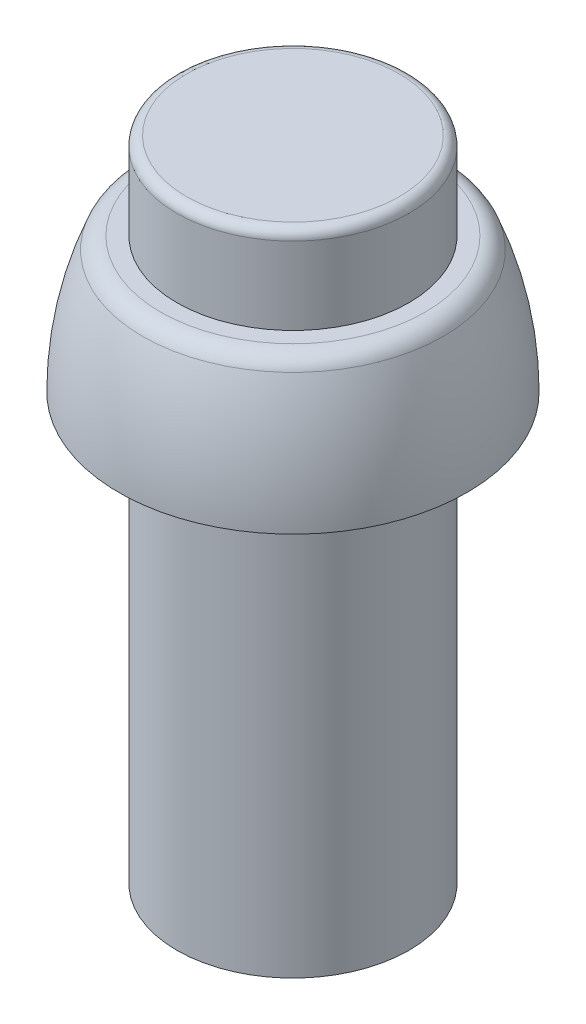
from build123d import *

# Parameters (mm, degrees)
CROQUIS1_R              = 6
SALIENTE_EXTRUIR1_DEPTH = 22
REDONDEO2_R             = 1
CROQUIS3_W              = 6
CROQUIS3_H              = 4.5
REDONDEO3_R             = 0.5


with BuildPart() as part:
    # Croquis1 → Saliente-Extruir1 (new body)
    with BuildSketch(Plane(origin=(0, 0, 0), x_dir=(1, 0, 0), z_dir=(0, 1, 0))):
        with Locations(Location((0, 0, 0), (0, 0, 270))):
            Circle(CROQUIS1_R)
    extrude(amount=-SALIENTE_EXTRUIR1_DEPTH)

    # Croquis2 → Revolución1 (revolve)
    with BuildSketch(Plane(origin=(0, 0, 0), x_dir=(0, 0, -1), z_dir=(1, 0, 0))):
        with BuildLine():
            Line((0, 0), (9, 0))
            ThreePointArc((9, 0), (8.62079124, 3.579455266), (7.5, 7))
            Line((7.5, 7), (0, 7))
            Line((0, 7), (0, 0))
        make_face()
    revolve(axis=Axis((0, 0, 0), (0, 1, 0)))

    # Redondeo2
    redondeo2_edges = [part.edges().sort_by_distance(p)[0] for p in [
        (0, 7, 7.5),
    ]]
    fillet(redondeo2_edges, radius=REDONDEO2_R)

    # Croquis3 → Revolución2 (revolve)
    with BuildSketch(Plane(origin=(0, 0, 0), x_dir=(0, 0, -1), z_dir=(1, 0, 0))):
        with Locations((3, 9.25)):
            Rectangle(CROQUIS3_W, CROQUIS3_H)
    revolve(axis=Axis((0, 7, 0), (0, 1, 0)))

    # Redondeo3
    redondeo3_edges = [part.edges().sort_by_distance(p)[0] for p in [
        (0, 11.5, 6),
    ]]
    fillet(redondeo3_edges, radius=REDONDEO3_R)


solid = part.part
